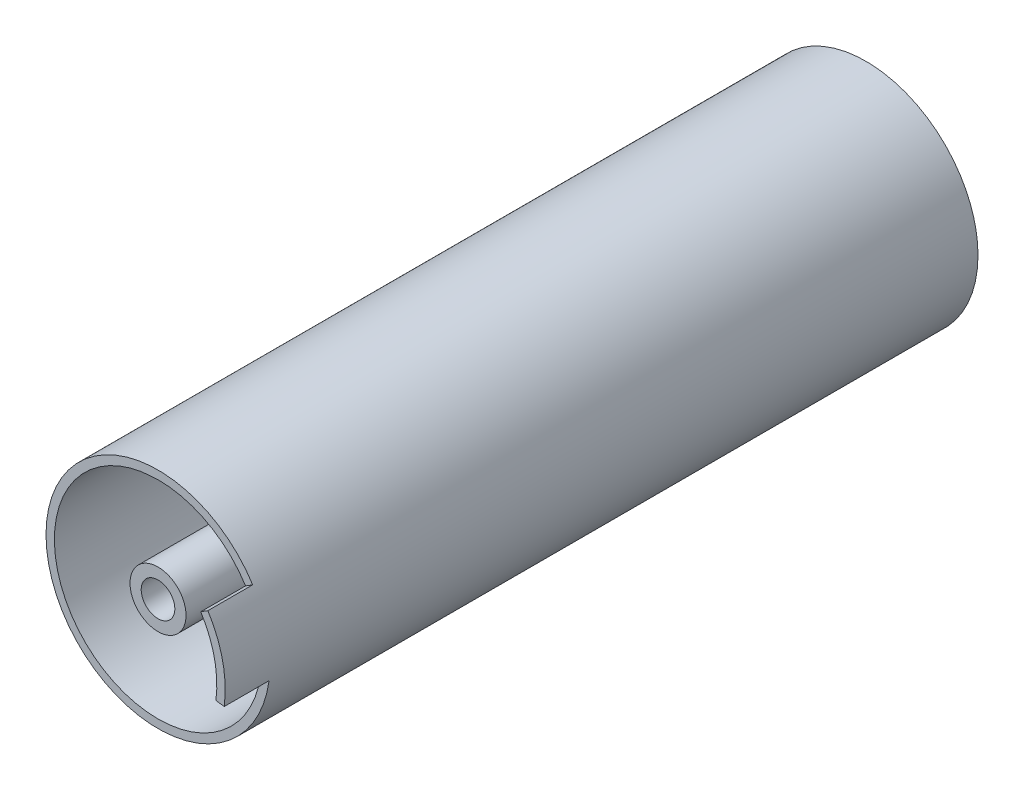
from build123d import *

# Parameters (mm, degrees)
SKETCH_2_R          = 20
SKETCH_2_R_2        = 18.5
EXTRUDE_1_DEPTH     = 126.4
SKETCH_5_R          = 3
EXTRUDE_3_DEPTH     = 126.4
CUT_EXTRUDE1_DEPTH  = 59
CUT_EXTRUDE2_DEPTH  = 59
SKETCH3_R           = 5
SKETCH3_R_2         = 3
BOSS_EXTRUDE1_DEPTH = 58.6
BOSS_EXTRUDE4_DEPTH = 8


with BuildPart() as part:
    # Эскиз2 → Бобышка-Вытянуть1 (new body)
    with BuildSketch(Plane.XY):
        Circle(SKETCH_2_R)
        Circle(SKETCH_2_R_2, mode=Mode.SUBTRACT)
    extrude(amount=EXTRUDE_1_DEPTH)

    # Эскиз5 → Бобышка-Вытянуть3 (add, through all)
    with BuildSketch(Plane(origin=(0, 0, 0), x_dir=(-1, 0, 0), z_dir=(0, 0, -1))):
        with BuildLine():
            Line((0, 18.5), (0, 9.219544457))
            ThreePointArc((0, 9.219544457), (-0.725705562, 6.35915669), (-2.727272727, 4.190702026))
            ThreePointArc((-2.727272727, 4.190702026), (-0.405405405, -4.983537544), (3.368749585, 3.694797184))
            ThreePointArc((3.368749585, 3.694797184), (1.743983113, 6.158250179), (1.490138787, 9.098323274))
            Line((1.490138787, 9.098323274), (2.990122527, 18.256756757))
            ThreePointArc((2.990122527, 18.256756757), (1.5, 18.439088915), (0, 18.5))
        make_face()
        Circle(SKETCH_5_R, mode=Mode.SUBTRACT)
    extrude(amount=-EXTRUDE_3_DEPTH)

    # Sketch1 → Cut-Extrude1 (cut)
    with BuildSketch(Plane(origin=(0, 0, 0), x_dir=(-1, 0, 0), z_dir=(0, 0, -1))):
        with BuildLine():
            Line((0, 18.5), (2.990122527, 18.256756757))
            ThreePointArc((2.990122527, 18.256756757), (-1.5, -18.439088915), (0, 18.5))
        make_face()
    extrude(amount=-CUT_EXTRUDE1_DEPTH, mode=Mode.SUBTRACT)

    # Sketch2 → Cut-Extrude2 (cut)
    with BuildSketch(Plane.XY.offset(126.4)):
        with BuildLine():
            Line((0, 18.5), (-2.990122527, 18.256756757))
            ThreePointArc((-2.990122527, 18.256756757), (1.50000041, -18.439093959), (0, 18.5))
        make_face()
    extrude(amount=-CUT_EXTRUDE2_DEPTH, mode=Mode.SUBTRACT)

    # Sketch6 → Boss-Extrude4 (add)
    with BuildSketch(Plane.XY.offset(126.4)):
        with BuildLine():
            Line((16.901505151, 10.692947377), (15.633892265, 9.890976324))
            ThreePointArc((15.633892265, 9.890976324), (18.073966336, 3.947371391), (18.334053323, -2.472344789))
            Line((18.334053323, -2.472344789), (19.820598187, -2.672805177))
            ThreePointArc((19.820598187, -2.672805177), (19.539423066, 4.267428531), (16.901505151, 10.692947377))
        make_face()
    extrude(amount=BOSS_EXTRUDE4_DEPTH)


with BuildPart() as body_2:
    # Sketch3 → Boss-Extrude1 (new body)
    with BuildSketch(Plane.XY.offset(126.4)):
        Circle(SKETCH3_R)
        Circle(SKETCH3_R_2, mode=Mode.SUBTRACT)
    extrude(amount=-BOSS_EXTRUDE1_DEPTH)


solid = Compound([part.part, body_2.part])
